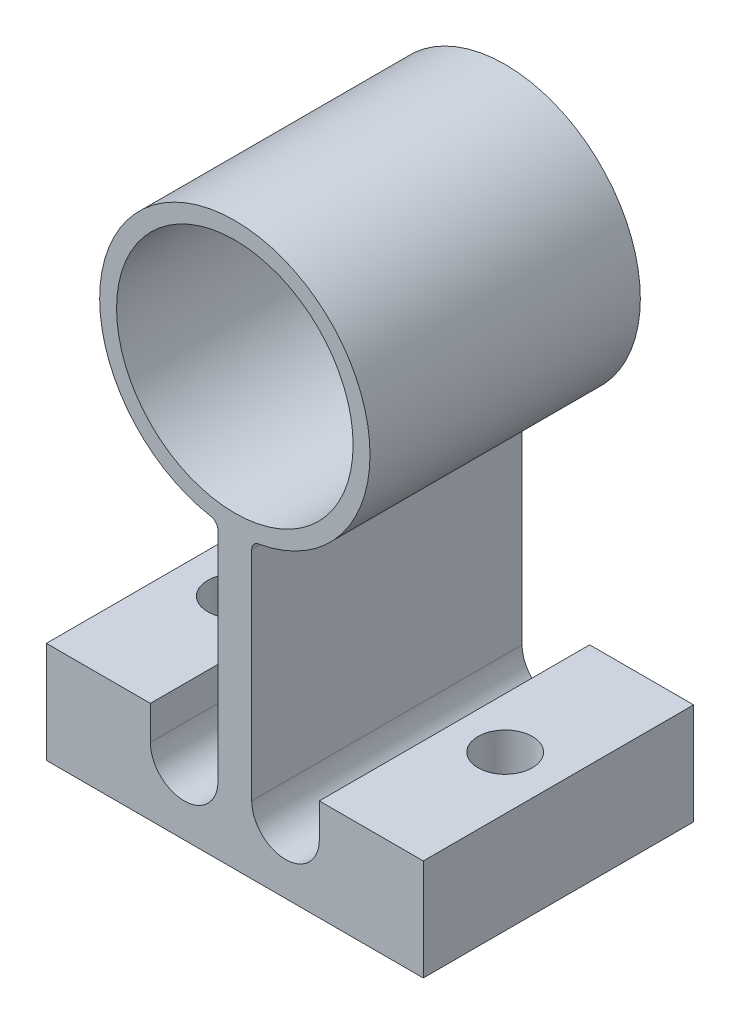
from build123d import *

# Parameters (mm, degrees)
SKETCH1_R                  = 11.1125
EXTRUDE1_DEPTH             = 12.7
BUSHING_SIDE_FILLETS_R     = 0.79375
MOUNT_SIDE_FILLETS_R       = 0.79375
F_1_4_MOUNTING_HOLES_D     = 5.1054
F_1_4_MOUNTING_HOLES_DEPTH = 19.05
F_1_4_MOUNTING_HOLES_TIP   = 1.533816902
EXTRUDE2_DEPTH             = 51.649420448


with BuildPart() as part:
    # Sketch1 → Extrude1 (new, symmetric)
    with BuildSketch(Plane(origin=(0, 0, 0), x_dir=(1, 0, 0), z_dir=(0, 0, -1))):
        with BuildLine():
            Line((-17.705953405, 40.0837), (17.705953405, 40.0837))
            Line((17.705953405, 40.0837), (17.705953405, 30.5587))
            Line((17.705953405, 30.5587), (1.5875, 30.5587))
            Line((1.5875, 30.5587), (1.5875, 12.600390619))
            ThreePointArc((1.5875, 12.600390619), (0, -12.7), (-1.5875, 12.600390619))
            Line((-1.5875, 12.600390619), (-1.5875, 30.5587))
            Line((-1.5875, 30.5587), (-17.705953405, 30.5587))
            Line((-17.705953405, 30.5587), (-17.705953405, 40.0837))
        make_face()
        with Locations(Location((0, 0, 0), (0, 0, 180))):
            Circle(SKETCH1_R, mode=Mode.SUBTRACT)
    extrude(amount=EXTRUDE1_DEPTH, both=True)

    # Bushing-side fillets
    bushing_side_fillets_edges = [part.edges().sort_by_distance(p)[0] for p in [
        (1.5875, -12.600390619, 0),
        (-1.5875, -12.600390619, 0),
    ]]
    fillet(bushing_side_fillets_edges, radius=BUSHING_SIDE_FILLETS_R)

    # Mount-side fillets
    mount_side_fillets_edges = [part.edges().sort_by_distance(p)[0] for p in [
        (1.5875, -30.5587, 0),
        (-1.5875, -30.5587, 0),
    ]]
    fillet(mount_side_fillets_edges, radius=MOUNT_SIDE_FILLETS_R)

    # 1/4 Mounting holes
    with Locations(Plane.XZ.offset(40.0837)):
        with Locations((-12.7, 0), (12.7, 0)):
            Hole(F_1_4_MOUNTING_HOLES_D / 2, depth=F_1_4_MOUNTING_HOLES_DEPTH)
            with Locations((0, 0, -(F_1_4_MOUNTING_HOLES_DEPTH + F_1_4_MOUNTING_HOLES_TIP / 2))):  # 118° drill point
                Cone(0, F_1_4_MOUNTING_HOLES_D / 2, F_1_4_MOUNTING_HOLES_TIP, mode=Mode.SUBTRACT)

    # Sketch4 → Extrude2 (cut, through all)
    with BuildSketch(Plane(origin=(0, 0, -12.7), x_dir=(-1, 0, 0), z_dir=(0, 0, -1))):
        with BuildLine():
            Line((1.5875, -29.76495), (1.5875, -33.7337))
            ThreePointArc((1.5875, -33.7337), (4.7625, -36.9087), (7.9375, -33.7337))
            Line((7.9375, -33.7337), (7.9375, -30.5587))
            Line((7.9375, -30.5587), (2.38125, -30.5587))
            ThreePointArc((2.38125, -30.5587), (1.819983992, -30.326216008), (1.5875, -29.76495))
        make_face()
        with BuildLine():
            Line((-7.9375, -30.5587), (-2.38125, -30.5587))
            ThreePointArc((-2.38125, -30.5587), (-1.819983992, -30.326216008), (-1.5875, -29.76495))
            Line((-1.5875, -29.76495), (-1.5875, -33.7337))
            ThreePointArc((-1.5875, -33.7337), (-4.7625, -36.9087), (-7.9375, -33.7337))
            Line((-7.9375, -33.7337), (-7.9375, -30.5587))
        make_face()
    extrude(amount=-EXTRUDE2_DEPTH, mode=Mode.SUBTRACT)


solid = part.part
